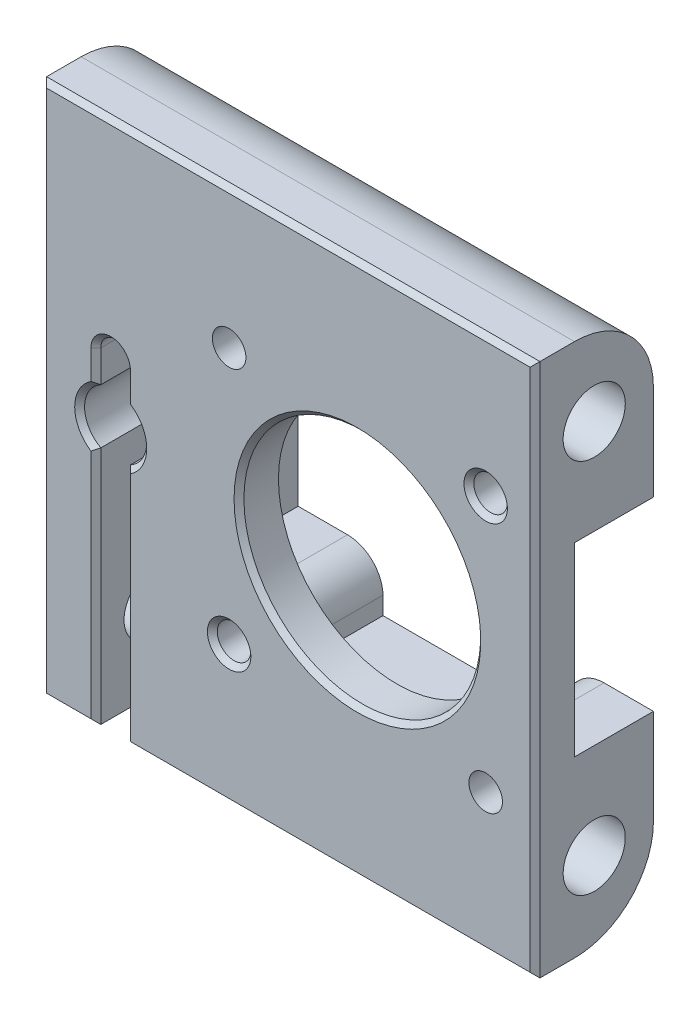
from build123d import *

# Parameters (mm, degrees)
SKETCH1_W           = 50
SKETCH1_H           = 54.105
BOSS_EXTRUDE1_DEPTH = 12
SKETCH2_R           = 3.15
CUT_EXTRUDE1_DEPTH  = 75.641483272
FILLET1_R           = 8
SKETCH3_R           = 12
SKETCH3_R_2         = 1.7
CUT_EXTRUDE2_DEPTH  = 75.641483272
CUT_EXTRUDE4_DEPTH  = 8
CHAMFER1_SIZE       = 0.5


with BuildPart() as part:
    # Sketch1 → Boss-Extrude1 (new body)
    with BuildSketch(Plane.XY):
        with Locations((25, 27.0525)):
            Rectangle(SKETCH1_W, SKETCH1_H)
    extrude(amount=BOSS_EXTRUDE1_DEPTH)

    # Sketch2 → Cut-Extrude1 (cut, through all)
    with BuildSketch(Plane(origin=(0, 0, 0), x_dir=(0, 0, -1), z_dir=(1, 0, 0))):
        with Locations((-6, 46.105)):
            Circle(SKETCH2_R)
        with Locations(Location((-6, 8, 0), (0, 0, 180))):
            Circle(SKETCH2_R)
    extrude(amount=CUT_EXTRUDE1_DEPTH, mode=Mode.SUBTRACT)

    # Fillet1
    fillet1_edges = [part.edges().sort_by_distance(p)[0] for p in [
        (25, 54.105, 0),
        (25, 0, 0),
    ]]
    fillet(fillet1_edges, radius=FILLET1_R)

    # Sketch3 → Cut-Extrude2 (cut, through all)
    with BuildSketch(Plane(origin=(0, 0, 0), x_dir=(-1, 0, 0), z_dir=(0, 0, -1))):
        with Locations((-32, 27.0525)):
            Circle(SKETCH3_R)
        with Locations((-19, 40.0525)):
            Circle(SKETCH3_R_2)
        with Locations((-19, 14.0525)):
            Circle(SKETCH3_R_2)
        with Locations((-45, 14.0525)):
            Circle(SKETCH3_R_2)
        with Locations((-45, 40.0525)):
            Circle(SKETCH3_R_2)
        with BuildLine():
            Line((-8.5, 0), (-8.5, 24.282572203))
            ThreePointArc((-8.5, 24.282572203), (-10.15, 27.0525), (-8.5, 29.822427797))
            Line((-8.5, 29.822427797), (-8.5, 33.0525))
            ThreePointArc((-8.5, 33.0525), (-7, 34.5525), (-5.5, 33.0525))
            Line((-5.5, 33.0525), (-5.5, 29.822427797))
            ThreePointArc((-5.5, 29.822427797), (-3.85, 27.0525), (-5.5, 24.282572203))
            Line((-5.5, 24.282572203), (-5.5, 0))
            Line((-5.5, 0), (-8.5, 0))
        make_face()
    extrude(amount=-CUT_EXTRUDE2_DEPTH, mode=Mode.SUBTRACT)

    # Sketch5 → Cut-Extrude4 (cut)
    with BuildSketch(Plane(origin=(0, 0, 0), x_dir=(-1, 0, 0), z_dir=(0, 0, -1))):
        with BuildLine():
            Line((-19, 17.6525), (-14, 17.6525))
            Line((-14, 17.6525), (-14, 36.4525))
            Line((-14, 36.4525), (-19, 36.4525))
            ThreePointArc((-19, 36.4525), (-21.510876341, 37.472674425), (-22.598679445, 39.955))
            Line((-22.598679445, 39.955), (-22.598679445, 41.7525))
            Line((-22.598679445, 41.7525), (-41.401320555, 41.7525))
            Line((-41.401320555, 41.7525), (-41.401320555, 39.955))
            ThreePointArc((-41.401320555, 39.955), (-42.489123659, 37.472674425), (-45, 36.4525))
            Line((-45, 36.4525), (-50, 36.4525))
            Line((-50, 36.4525), (-50, 17.6525))
            Line((-50, 17.6525), (-45, 17.6525))
            ThreePointArc((-45, 17.6525), (-42.489123659, 16.632325575), (-41.401320555, 14.15))
            Line((-41.401320555, 14.15), (-41.401320555, 12.3525))
            Line((-41.401320555, 12.3525), (-22.598679445, 12.3525))
            Line((-22.598679445, 12.3525), (-22.598679445, 14.15))
            ThreePointArc((-22.598679445, 14.15), (-21.510876341, 16.632325575), (-19, 17.6525))
        make_face()
    extrude(amount=-CUT_EXTRUDE4_DEPTH, mode=Mode.SUBTRACT)

    # Chamfer1
    chamfer1_edges = [part.edges().sort_by_distance(p)[0] for p in [
        (50, 27.0525, 12),
        (25, 54.105, 12),
        (0, 27.0525, 12),
        (29.25, 0, 12),
        (10.15, 27.0525, 12),
        (8.5, 31.437463898, 12),
        (7, 34.5525, 12),
        (5.5, 31.437463898, 12),
        (3.85, 27.0525, 12),
        (5.5, 12.141286102, 12),
        (8.5, 12.141286102, 12),
        (44, 27.0525, 12),
        (2.75, 0, 12),
        (20.7, 14.0525, 12),
        (46.7, 40.0525, 12),
    ]]
    chamfer(chamfer1_edges, length=CHAMFER1_SIZE)


solid = part.part
